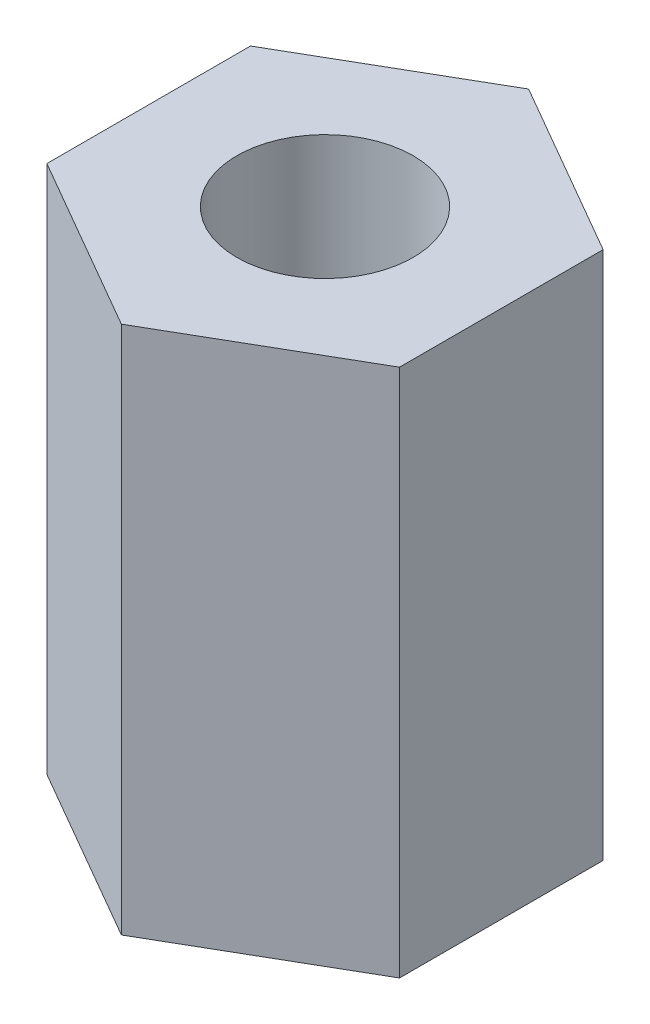
from build123d import *

# Parameters (mm, degrees)
SKETCH_1_R      = 1
EXTRUDE_1_DEPTH = 6


with BuildPart() as part:
    # 草图1 → 凸台-拉伸1 (new body)
    with BuildSketch(Plane(origin=(0, 0, 0), x_dir=(1, 0, 0), z_dir=(0, 1, 0))):
        Polygon((2, -1.154700538), (2, 1.154700538), (0, 2.309401077), (-2, 1.154700538), (-2, -1.154700538), (0, -2.309401077), align=None)
        with Locations(Location((0, 0, 0), (0, 0, 270))):
            Circle(SKETCH_1_R, mode=Mode.SUBTRACT)
    extrude(amount=EXTRUDE_1_DEPTH)


solid = part.part
